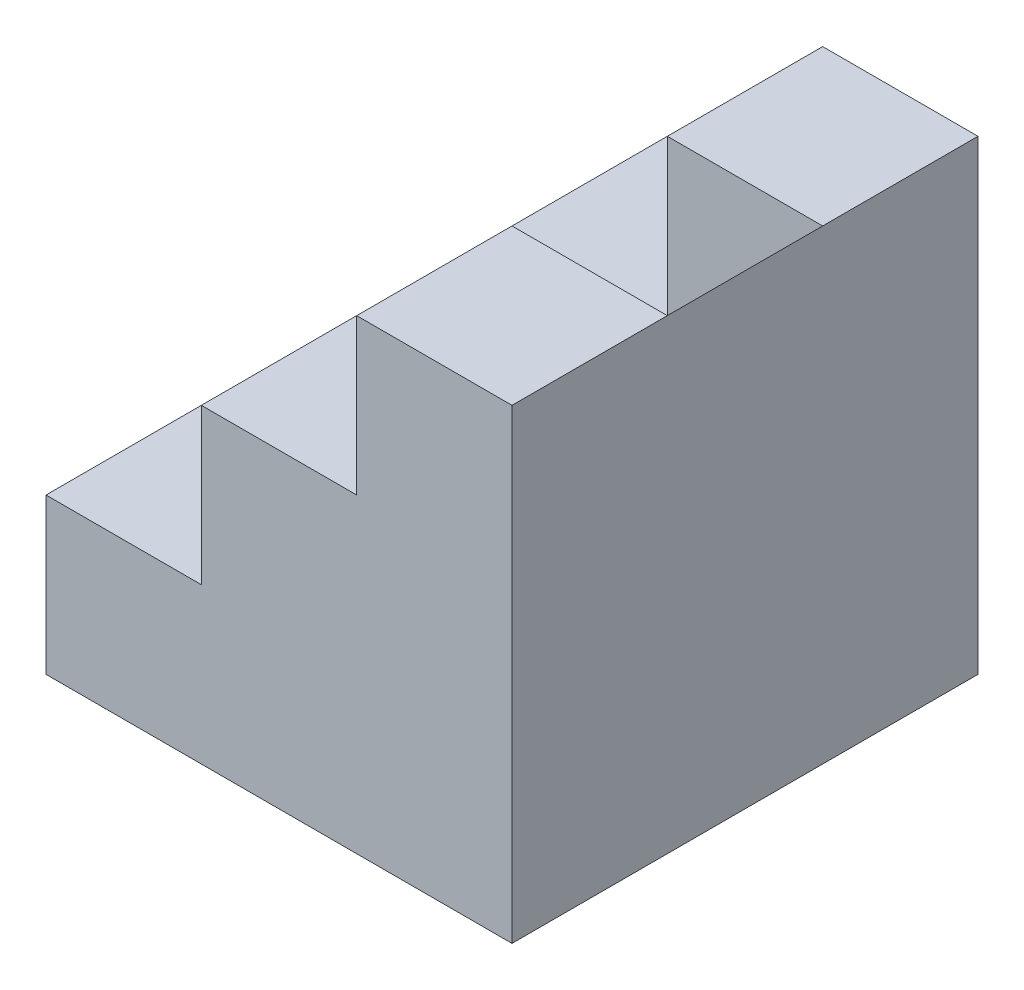
from build123d import *

# Parameters (mm, degrees)
CROQUIS1_W              = 60
CROQUIS1_H              = 60
SALIENTE_EXTRUIR2_DEPTH = 60
CROQUIS13_W             = 20
CROQUIS13_H             = 20
CORTAR_EXTRUIR15_DEPTH  = 20
CORTAR_EXTRUIR17_DEPTH  = 20
CROQUIS20_W             = 60
CROQUIS20_H             = 20
CORTAR_EXTRUIR19_DEPTH  = 104.923048454
SALIENTE_EXTRUIR3_REACH = 95.808


with BuildPart() as part:
    # Croquis1 → Saliente-Extruir2 (new body)
    with BuildSketch(Plane.XY):
        with Locations((-30, 30)):
            Rectangle(CROQUIS1_W, CROQUIS1_H)
    extrude(amount=-SALIENTE_EXTRUIR2_DEPTH)

    # Croquis13 → Cortar-Extruir15 (cut)
    with BuildSketch(Plane.XY):
        with Locations((-50, 30)):
            Rectangle(CROQUIS13_W, CROQUIS13_H)
        Polygon((-60, 60), (-60, 40), (-40, 40), (-20, 40), (-20, 60), align=None)
    extrude(amount=-CORTAR_EXTRUIR15_DEPTH, mode=Mode.SUBTRACT)

    # Croquis17 → Cortar-Extruir17 (cut)
    with BuildSketch(Plane(origin=(0, 0, -60), x_dir=(-1, 0, 0), z_dir=(0, 0, -1))):
        Polygon((60, 60), (20, 60), (20, 40), (40, 40), (40, 20), (60, 20), align=None)
    extrude(amount=-CORTAR_EXTRUIR17_DEPTH, mode=Mode.SUBTRACT)

    # Croquis20 → Cortar-Extruir19 (cut, through all)
    with BuildSketch(Plane(origin=(0, 60, 0), x_dir=(1, 0, 0), z_dir=(0, 1, 0))):
        with Locations((-30, 30)):
            Rectangle(CROQUIS20_W, CROQUIS20_H)
    extrude(amount=-CORTAR_EXTRUIR19_DEPTH, mode=Mode.SUBTRACT)


with BuildPart() as cortar_extruir19_piece_1:
    # of the separate pieces the step leaves, piece 1, a body of its own (cortar_extruir19_pieces)
    add(part.part.solids().sort_by_distance((-60, 0, -40))[0])


with BuildPart() as cortar_extruir19_piece_2:
    # of the separate pieces the step leaves, piece 2, a body of its own (cortar_extruir19_pieces)
    add(part.part.solids().sort_by_distance((0, 0, 0))[0])

    # Croquis21 → Saliente-Extruir3 (add, up to next)
    with BuildSketch(Plane.XY.offset(-40), mode=Mode.PRIVATE) as saliente_extruir3_sk1:
        Polygon((0, 60), (-60, 0), (0, 0), align=None)
    saliente_extruir3_tool1 = extrude(saliente_extruir3_sk1.sketch, amount=SALIENTE_EXTRUIR3_REACH, mode=Mode.PRIVATE) - cortar_extruir19_piece_2.part

    add(cortar_extruir19_piece_1.part)  # Saliente-Extruir3 merges Cortar-Extruir19 piece 1
    add(saliente_extruir3_tool1.solids().sort_by_distance((-20, 20, -40))[0])


solid = cortar_extruir19_piece_2.part
